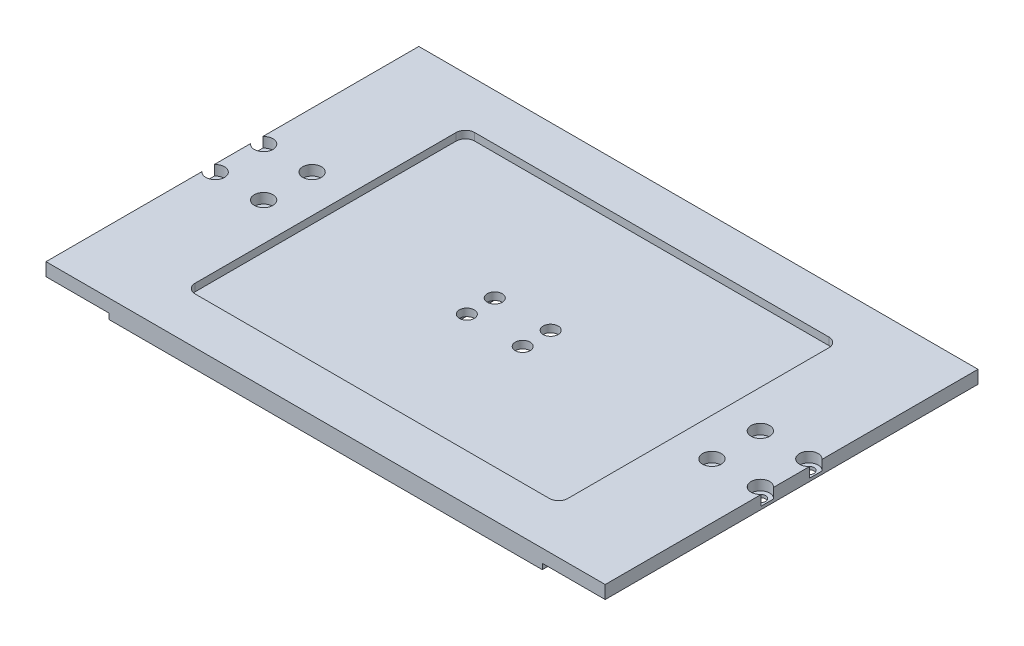
from build123d import *

# Parameters (mm, degrees)
SKETCH1_W                                           = 300
SKETCH1_H                                           = 200
BOSS_EXTRUDE1_DEPTH                                 = 10
CUT_EXTRUDE1_DEPTH                                  = 251.199920064
CUT_EXTRUDE1_DEPTH_BACK                             = 251.199920064
SKETCH2_W                                           = 33.75
SKETCH2_H                                           = 3
SKETCH3_W                                           = 200
SKETCH3_H                                           = 150
CUT_EXTRUDE2_DEPTH                                  = 4
FILLET1_R                                           = 5
CBORE_FOR_M5_HEX_SOCKET_HEAD_CAP_SCREW1_D           = 5.5
CBORE_FOR_M5_HEX_SOCKET_HEAD_CAP_SCREW1_CBORE_D     = 10
CBORE_FOR_M5_HEX_SOCKET_HEAD_CAP_SCREW1_CBORE_DEPTH = 5.4
SKETCH6_W                                           = 40
SKETCH6_H                                           = 30
CUT_EXTRUDE3_DEPTH                                  = 2
CBORE_FOR_M4_HEX_SOCKET_HEAD_CAP_SCREW1_D           = 4.5
CBORE_FOR_M4_HEX_SOCKET_HEAD_CAP_SCREW1_DEPTH       = 11.5
CBORE_FOR_M4_HEX_SOCKET_HEAD_CAP_SCREW1_CBORE_D     = 8
CBORE_FOR_M4_HEX_SOCKET_HEAD_CAP_SCREW1_CBORE_DEPTH = 4.4
CBORE_FOR_M4_HEX_SOCKET_HEAD_CAP_SCREW1_TIP         = 1.351936393


with BuildPart() as part:
    # Sketch1 → Boss-Extrude1 (new body)
    with BuildSketch(Plane(origin=(0, 0, 0), x_dir=(1, 0, 0), z_dir=(0, 1, 0))):
        Rectangle(SKETCH1_W, SKETCH1_H)
    extrude(amount=BOSS_EXTRUDE1_DEPTH)

    # Sketch2 → Cut-Extrude1 (cut, two sides: drawn at the far end of the back side and taken through both)
    with BuildSketch(Plane.XY.offset(100).offset(-CUT_EXTRUDE1_DEPTH_BACK)):
        with Locations((-133.125, 1.5)):
            Rectangle(SKETCH2_W, SKETCH2_H)
        with Locations((133.125, 1.5)):
            Rectangle(SKETCH2_W, SKETCH2_H)
    extrude(amount=CUT_EXTRUDE1_DEPTH + CUT_EXTRUDE1_DEPTH_BACK, mode=Mode.SUBTRACT)

    # Sketch3 → Cut-Extrude2 (cut)
    with BuildSketch(Plane(origin=(0, 10, 0), x_dir=(1, 0, 0), z_dir=(0, 1, 0))):
        Rectangle(SKETCH3_W, SKETCH3_H)
    extrude(amount=-CUT_EXTRUDE2_DEPTH, mode=Mode.SUBTRACT)

    # Fillet1
    fillet1_edges = [part.edges().sort_by_distance(p)[0] for p in [
        (-100, 8, 75),
        (-100, 8, -75),
        (100, 8, -75),
        (100, 8, 75),
    ]]
    fillet(fillet1_edges, radius=FILLET1_R)

    # CBORE for M5 Hex Socket Head Cap Screw1 (through all)
    with Locations(Plane(origin=(0, 10, 0), x_dir=(1, 0, 0), z_dir=(0, 1, 0))):
        with Locations((146.25, 13), (120.25, 13), (120.25, -13), (146.25, -13), (-146.25, 13), (-120.25, 13), (-146.25, -13), (-120.25, -13)):
            CounterBoreHole(CBORE_FOR_M5_HEX_SOCKET_HEAD_CAP_SCREW1_D / 2, CBORE_FOR_M5_HEX_SOCKET_HEAD_CAP_SCREW1_CBORE_D / 2, CBORE_FOR_M5_HEX_SOCKET_HEAD_CAP_SCREW1_CBORE_DEPTH)

    # Sketch6 → Cut-Extrude3 (cut)
    with BuildSketch(Plane.XZ):
        with Locations((-1.749998631, 0)):
            Rectangle(SKETCH6_W, SKETCH6_H)
    extrude(amount=-CUT_EXTRUDE3_DEPTH, mode=Mode.SUBTRACT)

    # CBORE for M4 Hex Socket Head Cap Screw1
    with Locations(Plane(origin=(0, 6, 0), x_dir=(1, 0, 0), z_dir=(0, 1, 0))):
        with Locations((13.249979912, 7.5), (13.249979912, -7.5), (-16.750020088, 7.5), (-16.750020088, -7.5)):
            CounterBoreHole(CBORE_FOR_M4_HEX_SOCKET_HEAD_CAP_SCREW1_D / 2, CBORE_FOR_M4_HEX_SOCKET_HEAD_CAP_SCREW1_CBORE_D / 2, CBORE_FOR_M4_HEX_SOCKET_HEAD_CAP_SCREW1_CBORE_DEPTH, depth=CBORE_FOR_M4_HEX_SOCKET_HEAD_CAP_SCREW1_DEPTH)
            with Locations((0, 0, -(CBORE_FOR_M4_HEX_SOCKET_HEAD_CAP_SCREW1_DEPTH + CBORE_FOR_M4_HEX_SOCKET_HEAD_CAP_SCREW1_TIP / 2))):  # 118° drill point
                Cone(0, CBORE_FOR_M4_HEX_SOCKET_HEAD_CAP_SCREW1_D / 2, CBORE_FOR_M4_HEX_SOCKET_HEAD_CAP_SCREW1_TIP, mode=Mode.SUBTRACT)


solid = part.part
